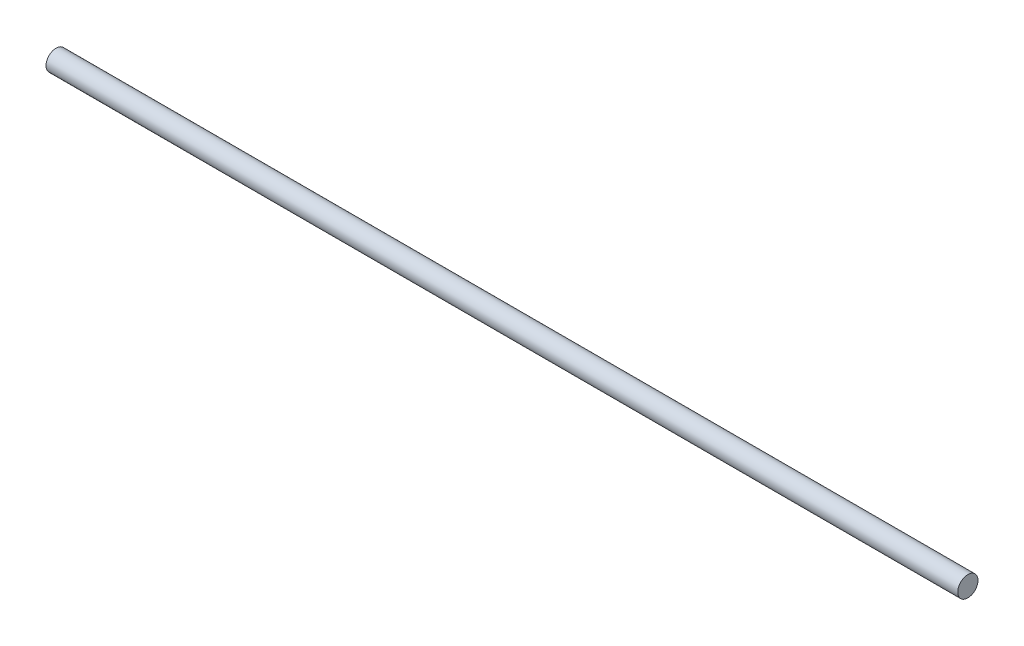
from build123d import *

# Parameters (mm, degrees)
SKETCH1_R      = 4.7625
EXTRUDE1_DEPTH = 214.3125


with BuildPart() as part:
    # Sketch1 → Extrude1 (new, symmetric)
    with BuildSketch(Plane(origin=(0, 0, 0), x_dir=(0, 0, -1), z_dir=(1, 0, 0))):
        Circle(SKETCH1_R)
    extrude(amount=EXTRUDE1_DEPTH, both=True)


solid = part.part
